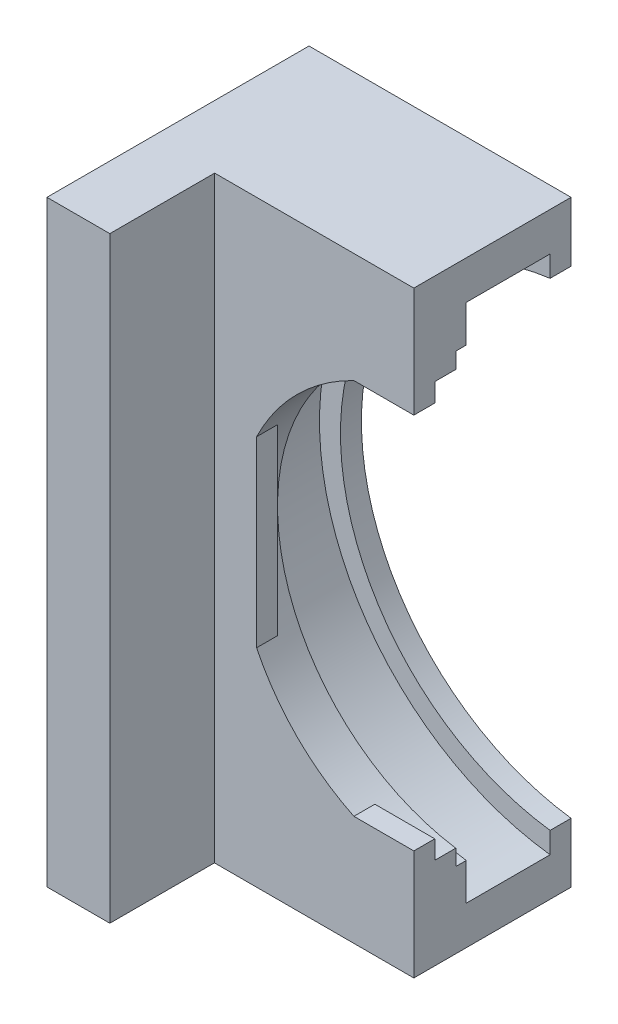
from build123d import *

# Parameters (mm, degrees)
SKETCH_1_W          = 12.5
SKETCH_1_H          = 28.5
EXTRUDE_1_DEPTH     = 7.5
SKETCH_2_W          = 3
SKETCH_2_H          = 28.488787575
EXTRUDE_2_DEPTH     = 5
SKETCH_3_R          = 11.5
CUT_EXTRUDE_1_DEPTH = 1
SKETCH_4_R          = 12.5
CUT_EXTRUDE_2_DEPTH = 4
SKETCH_5_R          = 10.75
CUT_EXTRUDE_3_DEPTH = 0.5
SKETCH_6_R          = 10
CUT_EXTRUDE_4_DEPTH = 1
SKETCH_7_W          = 18
SKETCH_7_H          = 18
CUT_EXTRUDE_5_DEPTH = 1
EXTRUDE_5_DEPTH     = 1


with BuildPart() as part:
    # 草图1 → 凸台-拉伸1 (new body)
    with BuildSketch(Plane.XY):
        Rectangle(SKETCH_1_W, SKETCH_1_H)
    extrude(amount=EXTRUDE_1_DEPTH)

    # 草图2 → 凸台-拉伸2 (add)
    with BuildSketch(Plane.XY.offset(7.5)):
        with Locations((-4.75, 0.005606212)):
            Rectangle(SKETCH_2_W, SKETCH_2_H)
    extrude(amount=EXTRUDE_2_DEPTH)

    # 草图3 → 切除-拉伸1 (cut)
    with BuildSketch(Plane(origin=(0, 0, 0), x_dir=(-1, 0, 0), z_dir=(0, 0, -1))):
        with Locations((-7.75, 0)):
            Circle(SKETCH_3_R)
    extrude(amount=-CUT_EXTRUDE_1_DEPTH, mode=Mode.SUBTRACT)

    # 草图4 → 切除-拉伸2 (cut)
    with BuildSketch(Plane(origin=(0, 0, 1), x_dir=(-1, 0, 0), z_dir=(0, 0, -1))):
        with Locations((-7.75, 0)):
            Circle(SKETCH_4_R)
    extrude(amount=-CUT_EXTRUDE_2_DEPTH, mode=Mode.SUBTRACT)

    # 草图5 → 切除-拉伸3 (cut)
    with BuildSketch(Plane(origin=(0, 0, 5), x_dir=(-1, 0, 0), z_dir=(0, 0, -1))):
        with Locations((-7.75, 0)):
            Circle(SKETCH_5_R)
    extrude(amount=-CUT_EXTRUDE_3_DEPTH, mode=Mode.SUBTRACT)

    # 草图6 → 切除-拉伸4 (cut)
    with BuildSketch(Plane(origin=(0, 0, 5.5), x_dir=(-1, 0, 0), z_dir=(0, 0, -1))):
        with Locations((-7.75, 0)):
            Circle(SKETCH_6_R)
    extrude(amount=-CUT_EXTRUDE_4_DEPTH, mode=Mode.SUBTRACT)

    # 草图7 → 切除-拉伸5 (cut)
    with BuildSketch(Plane(origin=(0, 0, 6.5), x_dir=(-1, 0, 0), z_dir=(0, 0, -1))):
        with Locations((-7.75, 0)):
            Rectangle(SKETCH_7_W, SKETCH_7_H)
    extrude(amount=-CUT_EXTRUDE_5_DEPTH, mode=Mode.SUBTRACT)

    # 草图9 → 凸台-拉伸5 (add)
    with BuildSketch(Plane.XY.offset(6.5)):
        with BuildLine():
            Line((3.391101056, 9), (-1.25, 9))
            Line((-1.25, 9), (-1.25, 4.358898944))
            ThreePointArc((-1.25, 4.358898944), (0.678932188, 7.071067812), (3.391101056, 9))
        make_face()
        with BuildLine():
            Line((-1.25, -4.358898944), (-1.25, -9))
            Line((-1.25, -9), (3.391101056, -9))
            ThreePointArc((3.391101056, -9), (0.678932188, -7.071067812), (-1.25, -4.358898944))
        make_face()
    extrude(amount=EXTRUDE_5_DEPTH)


solid = part.part
